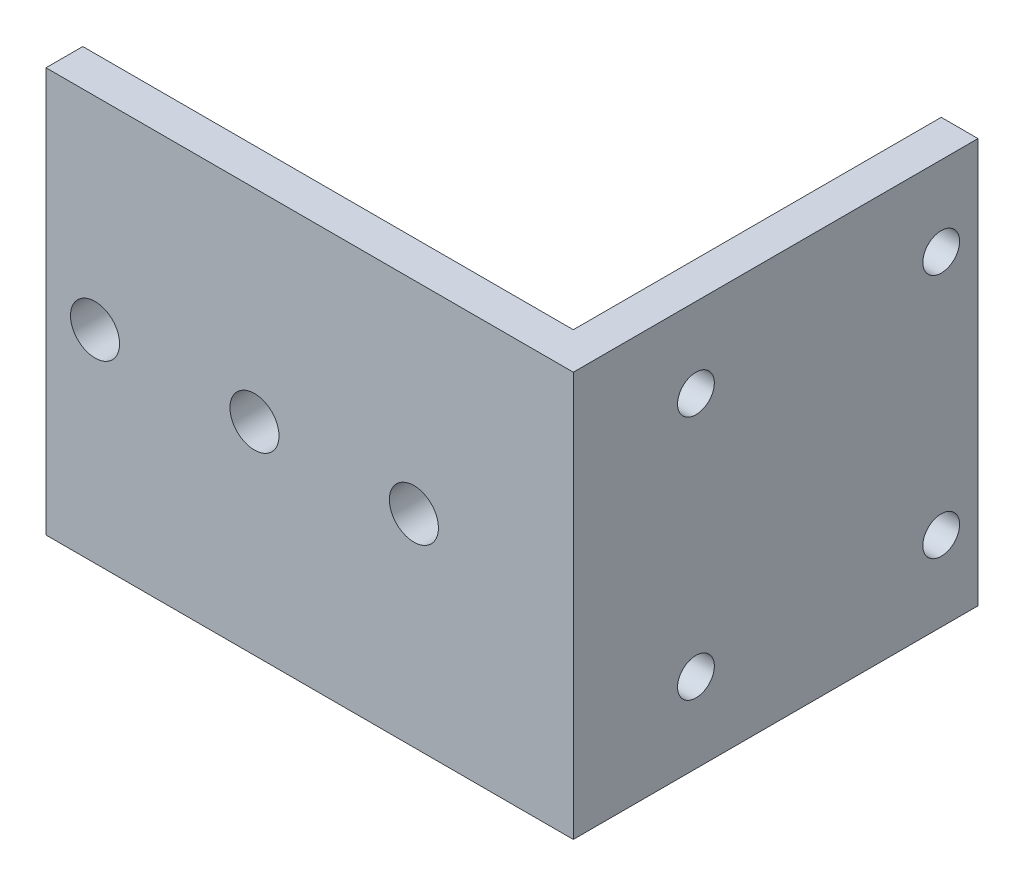
from build123d import *

# Parameters (mm, degrees)
EXTRUDE_1_DEPTH     = 33
CUT_EXTRUDE_1_REACH = 63.465
SKETCH_2_R          = 1.5
CUT_EXTRUDE_2_REACH = 63.952
SKETCH_3_R          = 2


with BuildPart() as part:
    # 草图1 → 凸台-拉伸1 (new body)
    with BuildSketch(Plane(origin=(0, 0, 0), x_dir=(1, 0, 0), z_dir=(0, 1, 0))):
        Polygon((0, 0), (43, 0), (43, 33), (40, 33), (40, 3), (0, 3), align=None)
    extrude(amount=EXTRUDE_1_DEPTH)

    # 草图2 → 切除-拉伸1 (cut, up to next)
    with BuildSketch(Plane.ZY.offset(-40), mode=Mode.PRIVATE) as cut_extrude_1_sk1:
        with Locations((-30, 6.5)):
            Circle(SKETCH_2_R)
    cut_extrude_1_tool1 = extrude(cut_extrude_1_sk1.sketch, amount=-CUT_EXTRUDE_1_REACH, mode=Mode.PRIVATE) & part.part
    # 草图2 → 切除-拉伸1 (cut, up to next)
    with BuildSketch(Plane.ZY.offset(-40), mode=Mode.PRIVATE) as cut_extrude_1_sk2:
        with Locations((-30, 26.5)):
            Circle(SKETCH_2_R)
    cut_extrude_1_tool2 = extrude(cut_extrude_1_sk2.sketch, amount=-CUT_EXTRUDE_1_REACH, mode=Mode.PRIVATE) & part.part
    # 草图2 → 切除-拉伸1 (cut, up to next)
    with BuildSketch(Plane.ZY.offset(-40), mode=Mode.PRIVATE) as cut_extrude_1_sk3:
        with Locations((-10, 6.5)):
            Circle(SKETCH_2_R)
    cut_extrude_1_tool3 = extrude(cut_extrude_1_sk3.sketch, amount=-CUT_EXTRUDE_1_REACH, mode=Mode.PRIVATE) & part.part
    # 草图2 → 切除-拉伸1 (cut, up to next)
    with BuildSketch(Plane.ZY.offset(-40), mode=Mode.PRIVATE) as cut_extrude_1_sk4:
        with Locations((-10, 26.5)):
            Circle(SKETCH_2_R)
    cut_extrude_1_tool4 = extrude(cut_extrude_1_sk4.sketch, amount=-CUT_EXTRUDE_1_REACH, mode=Mode.PRIVATE) & part.part
    add(cut_extrude_1_tool1.solids().sort_by_distance((40, 6.5, -30))[0], mode=Mode.SUBTRACT)
    add(cut_extrude_1_tool2.solids().sort_by_distance((40, 26.5, -30))[0], mode=Mode.SUBTRACT)
    add(cut_extrude_1_tool3.solids().sort_by_distance((40, 6.5, -10))[0], mode=Mode.SUBTRACT)
    add(cut_extrude_1_tool4.solids().sort_by_distance((40, 26.5, -10))[0], mode=Mode.SUBTRACT)

    # 草图3 → 切除-拉伸2 (cut, up to next)
    with BuildSketch(Plane(origin=(0, 0, -3), x_dir=(-1, 0, 0), z_dir=(0, 0, -1)), mode=Mode.PRIVATE) as cut_extrude_2_sk1:
        with Locations((-4, 16.5)):
            Circle(SKETCH_3_R)
    cut_extrude_2_tool1 = extrude(cut_extrude_2_sk1.sketch, amount=-CUT_EXTRUDE_2_REACH, mode=Mode.PRIVATE) & part.part
    # 草图3 → 切除-拉伸2 (cut, up to next)
    with BuildSketch(Plane(origin=(0, 0, -3), x_dir=(-1, 0, 0), z_dir=(0, 0, -1)), mode=Mode.PRIVATE) as cut_extrude_2_sk2:
        with Locations((-30, 16.5)):
            Circle(SKETCH_3_R)
    cut_extrude_2_tool2 = extrude(cut_extrude_2_sk2.sketch, amount=-CUT_EXTRUDE_2_REACH, mode=Mode.PRIVATE) & part.part
    # 草图3 → 切除-拉伸2 (cut, up to next)
    with BuildSketch(Plane(origin=(0, 0, -3), x_dir=(-1, 0, 0), z_dir=(0, 0, -1)), mode=Mode.PRIVATE) as cut_extrude_2_sk3:
        with Locations((-17, 16.5)):
            Circle(SKETCH_3_R)
    cut_extrude_2_tool3 = extrude(cut_extrude_2_sk3.sketch, amount=-CUT_EXTRUDE_2_REACH, mode=Mode.PRIVATE) & part.part
    add(cut_extrude_2_tool1.solids().sort_by_distance((4, 16.5, -3))[0], mode=Mode.SUBTRACT)
    add(cut_extrude_2_tool2.solids().sort_by_distance((30, 16.5, -3))[0], mode=Mode.SUBTRACT)
    add(cut_extrude_2_tool3.solids().sort_by_distance((17, 16.5, -3))[0], mode=Mode.SUBTRACT)


solid = part.part
